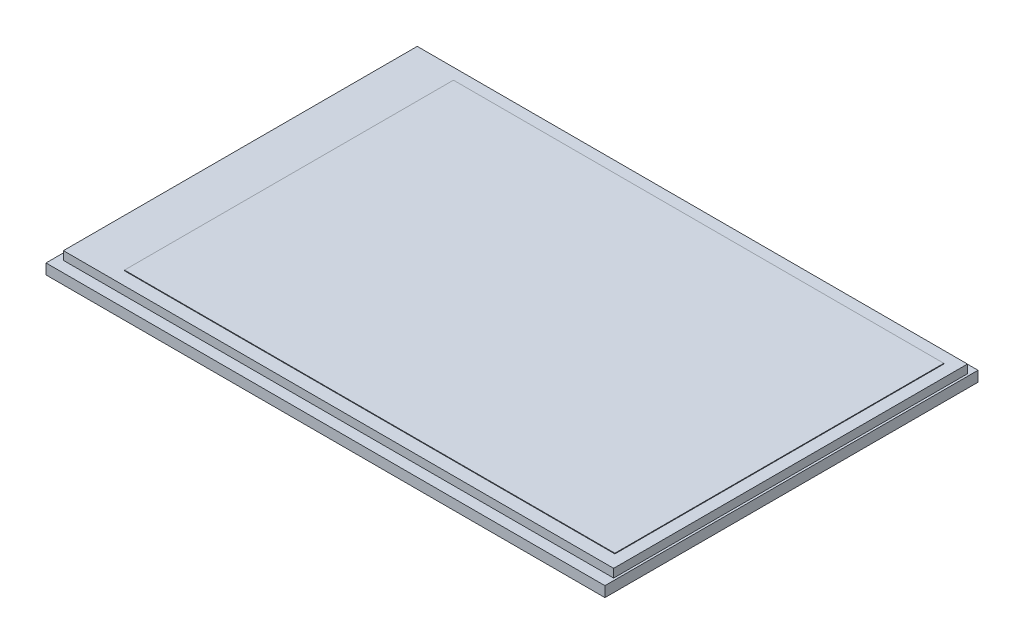
from build123d import *

# Parameters (mm, degrees)
SKETCH_1_W      = 86
SKETCH_1_H      = 57.4
EXTRUDE_1_DEPTH = 1.6
SKETCH_2_W      = 84.66
SKETCH_2_H      = 54.44
EXTRUDE_2_DEPTH = 1.3
SKETCH_3_W      = 75.45
SKETCH_3_H      = 50.61
EXTRUDE_3_DEPTH = 0.1
SKETCH_4_W      = 51.17
SKETCH_4_H      = 5
EXTRUDE_4_DEPTH = 14


with BuildPart() as part:
    # 草图1 → 凸台-拉伸1 (new body)
    with BuildSketch(Plane(origin=(0, 0, 0), x_dir=(1, 0, 0), z_dir=(0, 1, 0))):
        with Locations((-1.791666667, -4.811111111)):
            Rectangle(SKETCH_1_W, SKETCH_1_H)
    extrude(amount=EXTRUDE_1_DEPTH)

    # 草图2 → 凸台-拉伸2 (add)
    with BuildSketch(Plane(origin=(0, 1.6, 0), x_dir=(1, 0, 0), z_dir=(0, 1, 0))):
        with Locations((-1.461666667, -4.611111111)):
            Rectangle(SKETCH_2_W, SKETCH_2_H)
    extrude(amount=EXTRUDE_2_DEPTH)

    # 草图3 → 凸台-拉伸3 (add)
    with BuildSketch(Plane(origin=(0, 2.9, 0), x_dir=(1, 0, 0), z_dir=(0, 1, 0))):
        with Locations((1.323333333, -4.516111111)):
            Rectangle(SKETCH_3_W, SKETCH_3_H)
    extrude(amount=EXTRUDE_3_DEPTH)

    # 草图4 → 凸台-拉伸4 (add)
    with BuildSketch(Plane.XZ):
        with Locations((-11.666666667, -19.698888889)):
            Rectangle(SKETCH_4_W, SKETCH_4_H)
    extrude(amount=EXTRUDE_4_DEPTH)


solid = part.part
